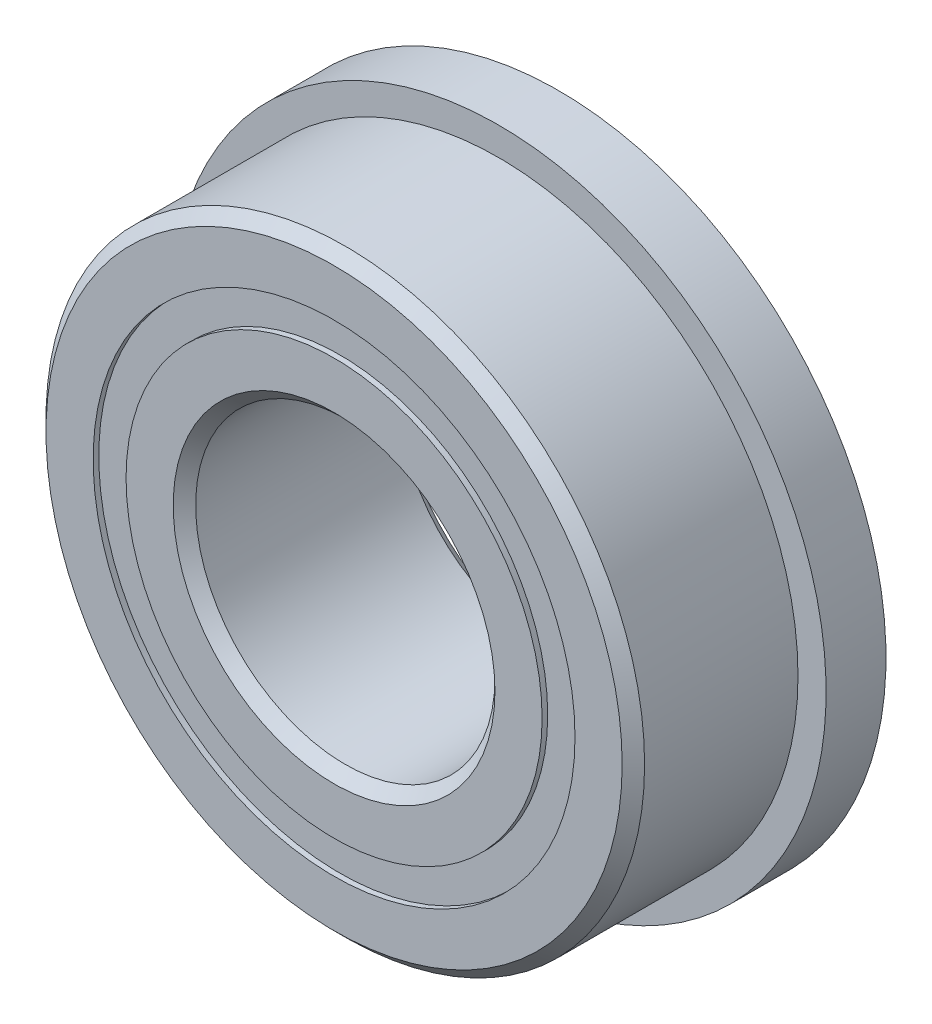
from build123d import *

# Parameters (mm, degrees)
CIRPATTERN1_COUNT = 12
SKETCH5_W         = 1.147826059
SKETCH5_H         = 0.697802198
SKETCH6_W         = 1.27
SKETCH6_H         = 1.835498901


with BuildPart() as part:
    # Sketch1 → Revolve1 (revolve)
    with BuildSketch(Plane(origin=(0, 0, 0), x_dir=(0, 0, -1), z_dir=(1, 0, 0)), mode=Mode.PRIVATE) as revolve1_sk:
        with BuildLine():
            Line((2.143125, 6.35), (-2.143125, 6.35))
            Line((-2.143125, 6.35), (-2.38125, 6.111875))
            Line((-2.38125, 6.111875), (-2.38125, 5.111401099))
            Line((-2.38125, 5.111401099), (-1.058333333, 5.111401099))
            ThreePointArc((-1.058333333, 5.111401099), (0, 5.876861441), (1.058333333, 5.111401099))
            Line((1.058333333, 5.111401099), (2.38125, 5.111401099))
            Line((2.38125, 5.111401099), (2.38125, 6.111875))
            Line((2.38125, 6.111875), (2.143125, 6.35))
        make_face()
    revolve(revolve1_sk.sketch.rotate(Axis((0, 0, 2.38125), (0, 0, -1)), 90), axis=Axis((0, 0, 2.38125), (0, 0, -1)))

    # Sketch6 → Revolve6 (revolve)
    with BuildSketch(Plane(origin=(0, 0, 0), x_dir=(0, 0, -1), z_dir=(1, 0, 0)), mode=Mode.PRIVATE) as revolve6_sk:
        with Locations((1.74625, 6.02915055)):
            Rectangle(SKETCH6_W, SKETCH6_H)
    revolve(revolve6_sk.sketch.rotate(Axis((0, 0, -2.38125), (0, 0, 1)), 270), axis=Axis((0, 0, -2.38125), (0, 0, 1)))


with BuildPart() as body_2:
    # Sketch3 → Revolve3 (revolve)
    with BuildSketch(Plane(origin=(0, 0, 0), x_dir=(0, 0, -1), z_dir=(1, 0, 0)), mode=Mode.PRIVATE) as revolve3_sk:
        with BuildLine():
            Line((-2.38125, 4.413598901), (-1.058333333, 4.413598901))
            ThreePointArc((-1.058333333, 4.413598901), (0, 3.648138559), (1.058333333, 4.413598901))
            Line((1.058333333, 4.413598901), (2.38125, 4.413598901))
            Line((2.38125, 4.413598901), (2.38125, 3.413125))
            Line((2.38125, 3.413125), (2.143125, 3.175))
            Line((2.143125, 3.175), (-2.143125, 3.175))
            Line((-2.143125, 3.175), (-2.38125, 3.413125))
            Line((-2.38125, 3.413125), (-2.38125, 4.413598901))
        make_face()
    revolve(revolve3_sk.sketch.rotate(Axis((0, 0, 2.38125), (0, 0, -1)), 90), axis=Axis((0, 0, 2.38125), (0, 0, -1)))


with BuildPart() as body_3:
    # Sketch4 → Revolve4 (revolve)
    with BuildSketch(Plane(origin=(0, 0, 0), x_dir=(0, 0, -1), z_dir=(1, 0, 0))):
        with BuildLine():
            Line((-1.114361441, 4.7625), (1.114361441, 4.7625))
            ThreePointArc((1.114361441, 4.7625), (0, 5.876861441), (-1.114361441, 4.7625))
        make_face()
    revolve(axis=Axis((0, 4.7625, 1.114361441), (0, 0, -1)))


with BuildPart() as cirpattern1_1:
    # CirPattern1: pattern copy
    add(body_3.part.rotate(Axis((0, 0, 0), (0, 0, 1)), 1 * 360 / CIRPATTERN1_COUNT))


with BuildPart() as cirpattern1_2:
    # CirPattern1: pattern copy
    add(body_3.part.rotate(Axis((0, 0, 0), (0, 0, 1)), 2 * 360 / CIRPATTERN1_COUNT))


with BuildPart() as cirpattern1_3:
    # CirPattern1: pattern copy
    add(body_3.part.rotate(Axis((0, 0, 0), (0, 0, 1)), 3 * 360 / CIRPATTERN1_COUNT))


with BuildPart() as cirpattern1_4:
    # CirPattern1: pattern copy
    add(body_3.part.rotate(Axis((0, 0, 0), (0, 0, 1)), 4 * 360 / CIRPATTERN1_COUNT))


with BuildPart() as cirpattern1_5:
    # CirPattern1: pattern copy
    add(body_3.part.rotate(Axis((0, 0, 0), (0, 0, 1)), 5 * 360 / CIRPATTERN1_COUNT))


with BuildPart() as cirpattern1_6:
    # CirPattern1: pattern copy
    add(body_3.part.rotate(Axis((0, 0, 0), (0, 0, 1)), 6 * 360 / CIRPATTERN1_COUNT))


with BuildPart() as cirpattern1_7:
    # CirPattern1: pattern copy
    add(body_3.part.rotate(Axis((0, 0, 0), (0, 0, 1)), 7 * 360 / CIRPATTERN1_COUNT))


with BuildPart() as cirpattern1_8:
    # CirPattern1: pattern copy
    add(body_3.part.rotate(Axis((0, 0, 0), (0, 0, 1)), 8 * 360 / CIRPATTERN1_COUNT))


with BuildPart() as cirpattern1_9:
    # CirPattern1: pattern copy
    add(body_3.part.rotate(Axis((0, 0, 0), (0, 0, 1)), 9 * 360 / CIRPATTERN1_COUNT))


with BuildPart() as cirpattern1_10:
    # CirPattern1: pattern copy
    add(body_3.part.rotate(Axis((0, 0, 0), (0, 0, 1)), 10 * 360 / CIRPATTERN1_COUNT))


with BuildPart() as cirpattern1_11:
    # CirPattern1: pattern copy
    add(body_3.part.rotate(Axis((0, 0, 0), (0, 0, 1)), 11 * 360 / CIRPATTERN1_COUNT))


with BuildPart() as body_15:
    # Sketch5 → Revolve5 (revolve)
    with BuildSketch(Plane(origin=(0, 0, 0), x_dir=(0, 0, -1), z_dir=(1, 0, 0)), mode=Mode.PRIVATE) as revolve5_sk:
        with Locations((-1.688274471, 4.7625)):
            Rectangle(SKETCH5_W, SKETCH5_H)
        with Locations((1.688274471, 4.7625)):
            Rectangle(SKETCH5_W, SKETCH5_H)
    revolve(revolve5_sk.sketch.rotate(Axis((0, 0, 2.38125), (0, 0, -1)), 90), axis=Axis((0, 0, 2.38125), (0, 0, -1)))


solid = Compound([part.part, body_2.part, body_3.part, cirpattern1_1.part, cirpattern1_2.part, cirpattern1_3.part, cirpattern1_4.part, cirpattern1_5.part, cirpattern1_6.part, cirpattern1_7.part, cirpattern1_8.part, cirpattern1_9.part, cirpattern1_10.part, cirpattern1_11.part, body_15.part])
